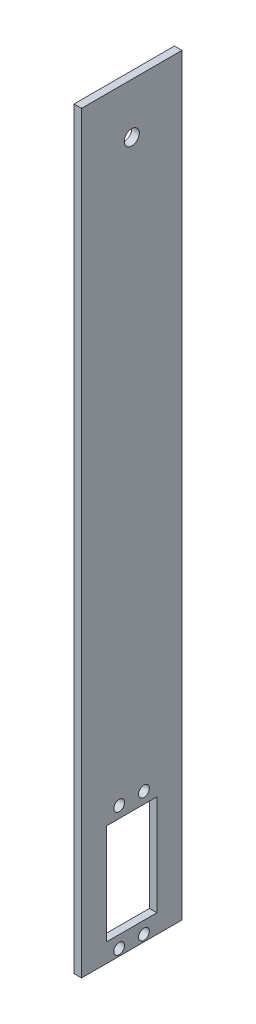
from build123d import *

# Parameters (mm, degrees)
SKETCH1_W           = 40
SKETCH1_H           = 300
BOSS_EXTRUDE1_DEPTH = 3
SKETCH2_R           = 3
CUT_EXTRUDE1_DEPTH  = 3
SKETCH3_R           = 2.15
SKETCH3_W           = 20
SKETCH3_H           = 40
CUT_EXTRUDE2_DEPTH  = 3


with BuildPart() as part:
    # Sketch1 → Boss-Extrude1 (new body)
    with BuildSketch(Plane(origin=(0, 0, 0), x_dir=(0, 0, -1), z_dir=(1, 0, 0))):
        Rectangle(SKETCH1_W, SKETCH1_H)
    extrude(amount=BOSS_EXTRUDE1_DEPTH)

    # Sketch2 → Cut-Extrude1 (cut)
    with BuildSketch(Plane(origin=(3, 0, 0), x_dir=(0, 0, -1), z_dir=(1, 0, 0))):
        with Locations((0, 130)):
            Circle(SKETCH2_R)
    extrude(amount=-CUT_EXTRUDE1_DEPTH, mode=Mode.SUBTRACT)

    # Sketch3 → Cut-Extrude2 (cut)
    with BuildSketch(Plane(origin=(3, 0, 0), x_dir=(0, 0, -1), z_dir=(1, 0, 0))):
        with Locations((-5.025, -147.31)):
            Circle(SKETCH3_R)
        with Locations((4.845, -147.31)):
            Circle(SKETCH3_R)
        with Locations((-5.025, -98.01)):
            Circle(SKETCH3_R)
        with Locations((4.845, -98.01)):
            Circle(SKETCH3_R)
        with Locations((0, -122.5)):
            Rectangle(SKETCH3_W, SKETCH3_H)
    extrude(amount=-CUT_EXTRUDE2_DEPTH, mode=Mode.SUBTRACT)


solid = part.part
